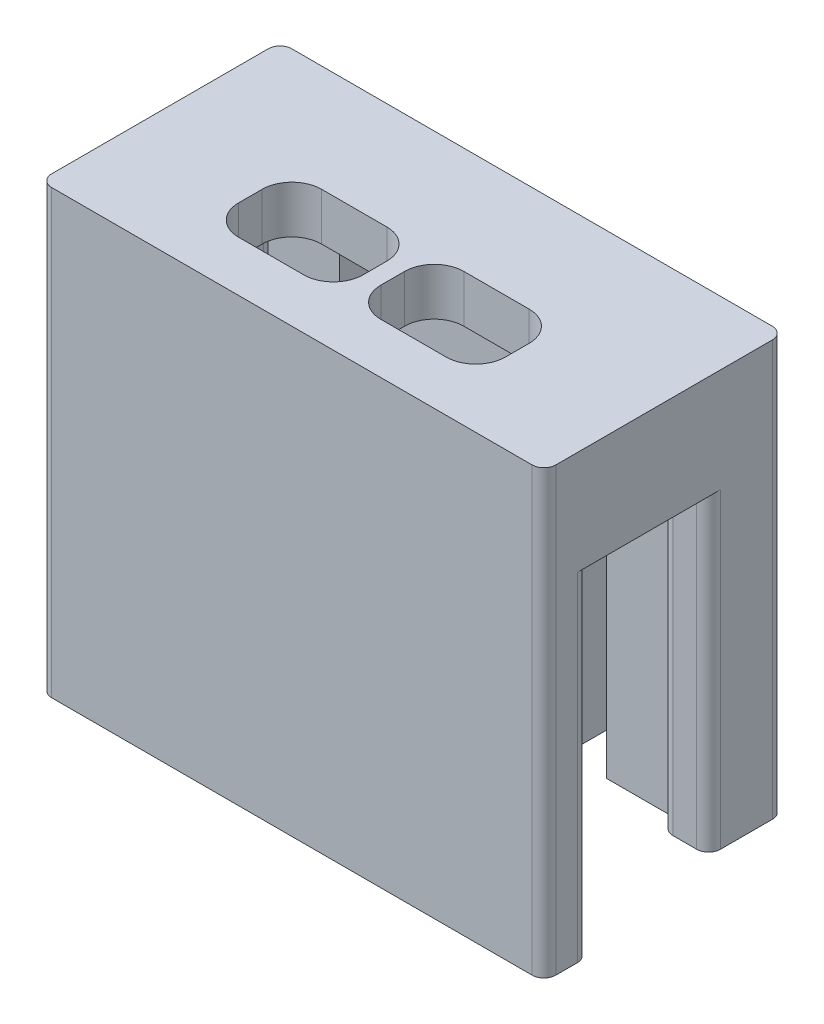
from build123d import *

# Parameters (mm, degrees)
SKETCH1_W               = 65
SKETCH1_H               = 60
BOSS_EXTRUDE1_DEPTH     = 10
SKETCH6_W               = 10
SKETCH6_H               = 1
BOSS_EXTRUDE6_DEPTH     = 1
CUT_EXTRUDE2_DEPTH      = 1
CUT_EXTRUDE2_DEPTH_BACK = 73.945184899
BOSS_EXTRUDE2_DEPTH     = 33
SKETCH2_W               = 20.25
SKETCH2_H               = 52.5
CUT_EXTRUDE1_DEPTH      = 100.569071503
BOSS_EXTRUDE3_DEPTH     = 7.5
SKETCH5_W               = 85
SKETCH5_H               = 7.611423687
BOSS_EXTRUDE5_DEPTH     = 70
SKETCH8_W               = 65
SKETCH8_H               = 22.888576313
CUT_EXTRUDE3_DEPTH      = 2
CUT_EXTRUDE4_DEPTH      = 2
SKETCH11_W              = 7
SKETCH11_H              = 60
CUT_EXTRUDE5_DEPTH      = 12.75
CUT_EXTRUDE6_REACH      = 93.359
SKETCH10_W              = 15
SKETCH10_H              = 8
FILLET1_R               = 2
BOSS_EXTRUDE7_START     = 4.5
BOSS_EXTRUDE7_DEPTH     = 4.5
CUT_EXTRUDE8_REACH      = 96.851


with BuildPart() as part:
    # Sketch1 → Boss-Extrude1 (new body)
    with BuildSketch(Plane.XY):
        Rectangle(SKETCH1_W, SKETCH1_H)
        Polygon((32.5, -30), (32.5, 30), (-32.5, 30), (-32.5, -30), (-42.5, -30), (-42.5, 40), (42.5, 40), (42.5, -30), align=None)
    extrude(amount=BOSS_EXTRUDE1_DEPTH)

    # Sketch6 → Boss-Extrude6 (add)
    with BuildSketch(Plane.XY.offset(10)):
        with Locations((12.5, 17)):
            Rectangle(SKETCH6_W, SKETCH6_H)
        with Locations((-12.5, 17)):
            Rectangle(SKETCH6_W, SKETCH6_H)
    extrude(amount=BOSS_EXTRUDE6_DEPTH)

    # Sketch7 → Cut-Extrude2 (cut, two sides: drawn at the far end of the back side and taken through both)
    with BuildSketch(Plane(origin=(17.5, 0, 0), x_dir=(0, 0, -1), z_dir=(1, 0, 0)).offset(-CUT_EXTRUDE2_DEPTH_BACK)):
        Polygon((-10, 16.5), (-11, 17.5), (-11, 16.5), align=None)
    extrude(amount=CUT_EXTRUDE2_DEPTH + CUT_EXTRUDE2_DEPTH_BACK, mode=Mode.SUBTRACT)

    # Sketch1<3> → Boss-Extrude2 (add)
    with BuildSketch(Plane.XY):
        Polygon((32.5, -30), (32.5, 30), (-32.5, 30), (-32.5, -30), (-42.5, -30), (-42.5, 40), (42.5, 40), (42.5, -30), align=None)
    extrude(amount=BOSS_EXTRUDE2_DEPTH)

    # Sketch2 → Cut-Extrude1 (cut, through all)
    with BuildSketch(Plane.ZY.offset(42.5)):
        with Locations((22.875, -3.75)):
            Rectangle(SKETCH2_W, SKETCH2_H)
    extrude(amount=-CUT_EXTRUDE1_DEPTH, mode=Mode.SUBTRACT)

    # Sketch3 → Boss-Extrude3 (add)
    with BuildSketch(Plane.XY.offset(33)):
        Polygon((32.5, 22.5), (42.5, 22.5), (42.5, 40), (-42.5, 40), (-42.5, 22.5), (-32.5, 22.5), (-32.5, 30), (32.5, 30), align=None)
    extrude(amount=BOSS_EXTRUDE3_DEPTH)

    # Sketch5 → Boss-Extrude5 (add)
    with BuildSketch(Plane(origin=(0, 40, 0), x_dir=(1, 0, 0), z_dir=(0, 1, 0))):
        with Locations((0, -36.694288157)):
            Rectangle(SKETCH5_W, SKETCH5_H)
    extrude(amount=-BOSS_EXTRUDE5_DEPTH)

    # Sketch8 → Cut-Extrude3 (cut)
    with BuildSketch(Plane.XZ.offset(-30)):
        with Locations((0, 21.444288157)):
            Rectangle(SKETCH8_W, SKETCH8_H)
    extrude(amount=-CUT_EXTRUDE3_DEPTH, mode=Mode.SUBTRACT)

    # Sketch9 → Cut-Extrude4 (cut)
    with BuildSketch(Plane.ZY.offset(-32.5)):
        Polygon((32.888576313, 22.5), (32.888576313, 32), (10, 32), (10, -30), (12.75, -30), (12.75, 22.5), align=None)
    cut_extrude4 = extrude(amount=-CUT_EXTRUDE4_DEPTH, mode=Mode.SUBTRACT)

    # Mirror1: Cut-Extrude4 across plane
    add(cut_extrude4.mirror(Plane(origin=(0, 0, 0), x_dir=(0, 0, 1), z_dir=(1, 0, 0))), mode=Mode.SUBTRACT)

    # Sketch11 → Cut-Extrude5 (cut)
    with BuildSketch(Plane(origin=(0, 0, 0), x_dir=(-1, 0, 0), z_dir=(0, 0, -1))):
        with Locations((-19, 0)):
            Rectangle(SKETCH11_W, SKETCH11_H)
    cut_extrude5 = extrude(amount=-CUT_EXTRUDE5_DEPTH, mode=Mode.SUBTRACT)

    # Mirror2: Cut-Extrude5 across plane
    add(cut_extrude5.mirror(Plane(origin=(0, 0, 0), x_dir=(0, 0, 1), z_dir=(1, 0, 0))), mode=Mode.SUBTRACT)

    # Sketch10 → Cut-Extrude6 (cut, up to next)
    with BuildSketch(Plane(origin=(0, 40, 0), x_dir=(1, 0, 0), z_dir=(0, 1, 0)), mode=Mode.PRIVATE) as cut_extrude6_sk1:
        with Locations((12, -25)):
            Rectangle(SKETCH10_W, SKETCH10_H)
    cut_extrude6_tool1 = extrude(cut_extrude6_sk1.sketch, amount=-CUT_EXTRUDE6_REACH, mode=Mode.PRIVATE) & part.part
    cut_extrude6 = cut_extrude6_tool1.solids().sort_by_distance((12, 40, 25))[0]
    add(cut_extrude6, mode=Mode.SUBTRACT)

    # Mirror4: Cut-Extrude6 across plane
    add(cut_extrude6.mirror(Plane(origin=(0, 0, 0), x_dir=(0, 0, 1), z_dir=(1, 0, 0))), mode=Mode.SUBTRACT)

    # Fillet1
    fillet1_edges = [part.edges().sort_by_distance(p)[0] for p in [
        (42.5, -3.75, 12.75),
        (-42.5, -3.75, 12.75),
        (42.5, 5, 40.5),
        (-42.5, 5, 40.5),
        (-42.5, -3.75, 32.888576313),
        (42.5, -3.75, 32.888576313),
        (34.5, -3.75, 12.75),
        (-34.5, -3.75, 12.75),
        (4.5, 36, 29),
        (4.5, 36, 21),
        (19.5, 36, 21),
        (19.5, 36, 29),
        (-4.5, 36, 21),
        (-4.5, 36, 29),
        (-19.5, 36, 29),
        (-19.5, 36, 21),
        (-42.5, 5, 0),
        (42.5, 5, 0),
    ]]
    fillet(fillet1_edges, radius=FILLET1_R)

    # Sketch12 → Boss-Extrude7 (add)
    with BuildSketch(Plane.XZ.offset(30).offset(BOSS_EXTRUDE7_START)):
        with BuildLine():
            Line((-42.5, 38.5), (-42.5, 34.888576313))
            ThreePointArc((-42.5, 34.888576313), (-41.914213562, 33.474362751), (-40.5, 32.888576313))
            Line((-40.5, 32.888576313), (40.5, 32.888576313))
            ThreePointArc((40.5, 32.888576313), (41.914213562, 33.474362751), (42.5, 34.888576313))
            Line((42.5, 34.888576313), (42.5, 38.5))
            ThreePointArc((42.5, 38.5), (41.914213562, 39.914213562), (40.5, 40.5))
            Line((40.5, 40.5), (-40.5, 40.5))
            ThreePointArc((-40.5, 40.5), (-41.914213562, 39.914213562), (-42.5, 38.5))
        make_face()
    extrude(amount=-BOSS_EXTRUDE7_DEPTH)

    # Sketch14 → Cut-Extrude8 (cut, up to next)
    with BuildSketch(Plane(origin=(0, 40, 0), x_dir=(1, 0, 0), z_dir=(0, 1, 0)), mode=Mode.PRIVATE) as cut_extrude8_sk1:
        with BuildLine():
            Line((17.5, -18), (6.5, -18))
            ThreePointArc((6.5, -18), (2.964466094, -19.464466094), (1.5, -23))
            Line((1.5, -23), (1.5, -27))
            ThreePointArc((1.5, -27), (2.964466094, -30.535533906), (6.5, -32))
            Line((6.5, -32), (17.5, -32))
            ThreePointArc((17.5, -32), (21.035533906, -30.535533906), (22.5, -27))
            Line((22.5, -27), (22.5, -23))
            ThreePointArc((22.5, -23), (21.035533906, -19.464466094), (17.5, -18))
        make_face()
        with BuildLine():
            Line((19.5, -27), (19.5, -23))
            ThreePointArc((19.5, -23), (18.914213562, -21.585786438), (17.5, -21))
            Line((17.5, -21), (6.5, -21))
            ThreePointArc((6.5, -21), (5.085786438, -21.585786438), (4.5, -23))
            Line((4.5, -23), (4.5, -27))
            ThreePointArc((4.5, -27), (5.085786438, -28.414213562), (6.5, -29))
            Line((6.5, -29), (17.5, -29))
            ThreePointArc((17.5, -29), (18.914213562, -28.414213562), (19.5, -27))
        make_face(mode=Mode.SUBTRACT)
    cut_extrude8_tool1 = extrude(cut_extrude8_sk1.sketch, amount=-CUT_EXTRUDE8_REACH, mode=Mode.PRIVATE) & part.part
    # Sketch14 → Cut-Extrude8 (cut, up to next)
    with BuildSketch(Plane(origin=(0, 40, 0), x_dir=(1, 0, 0), z_dir=(0, 1, 0)), mode=Mode.PRIVATE) as cut_extrude8_sk2:
        with BuildLine():
            Line((-1.5, -23), (-1.5, -27))
            ThreePointArc((-1.5, -27), (-2.964466094, -30.535533906), (-6.5, -32))
            Line((-6.5, -32), (-17.5, -32))
            ThreePointArc((-17.5, -32), (-21.035533906, -30.535533906), (-22.5, -27))
            Line((-22.5, -27), (-22.5, -23))
            ThreePointArc((-22.5, -23), (-21.035533906, -19.464466094), (-17.5, -18))
            Line((-17.5, -18), (-6.5, -18))
            ThreePointArc((-6.5, -18), (-2.964466094, -19.464466094), (-1.5, -23))
        make_face()
        with BuildLine():
            Line((-6.5, -29), (-17.5, -29))
            ThreePointArc((-17.5, -29), (-18.914213562, -28.414213562), (-19.5, -27))
            Line((-19.5, -27), (-19.5, -23))
            ThreePointArc((-19.5, -23), (-18.914213562, -21.585786438), (-17.5, -21))
            Line((-17.5, -21), (-6.5, -21))
            ThreePointArc((-6.5, -21), (-5.085786438, -21.585786438), (-4.5, -23))
            Line((-4.5, -23), (-4.5, -27))
            ThreePointArc((-4.5, -27), (-5.085786438, -28.414213562), (-6.5, -29))
        make_face(mode=Mode.SUBTRACT)
    cut_extrude8_tool2 = extrude(cut_extrude8_sk2.sketch, amount=-CUT_EXTRUDE8_REACH, mode=Mode.PRIVATE) & part.part
    add(cut_extrude8_tool1.solids().sort_by_distance((12, 40, 18.252389))[0], mode=Mode.SUBTRACT)
    add(cut_extrude8_tool2.solids().sort_by_distance((-1.752389, 40, 25))[0], mode=Mode.SUBTRACT)


solid = part.part
